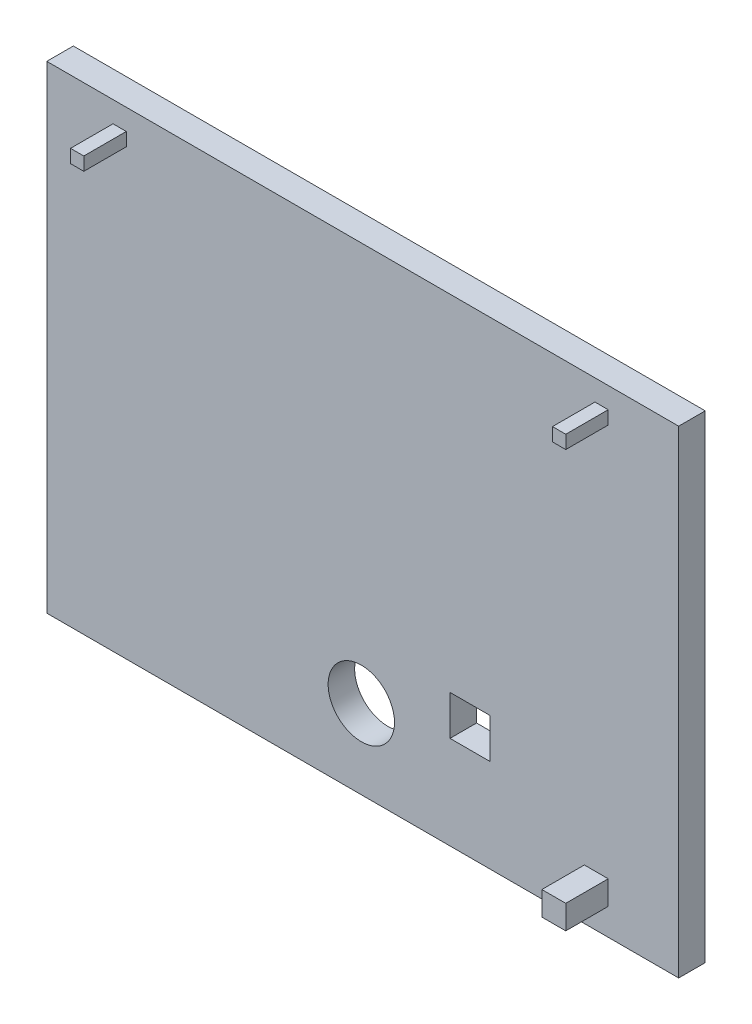
from build123d import *

# Parameters (mm, degrees)
SKETCH1_W           = 119
SKETCH1_H           = 90
SKETCH1_R           = 6.25
SKETCH1_W_2         = 7.5
SKETCH1_H_2         = 7.5
BOSS_EXTRUDE1_DEPTH = 5
SKETCH1_3_W         = 2.5
SKETCH1_3_H         = 2.5
SKETCH1_3_W_2       = 4.5
SKETCH1_3_H_2       = 4.5
BOSS_EXTRUDE2_DEPTH = 13


with BuildPart() as part:
    # Sketch1 → Boss-Extrude1 (new body)
    with BuildSketch(Plane.XY):
        with Locations((34.214905029, -83.582846692)):
            Rectangle(SKETCH1_W, SKETCH1_H)
        with Locations((33.949905029, -113.682846692)):
            Circle(SKETCH1_R, mode=Mode.SUBTRACT)
        with Locations((54.399905029, -107.282846692)):
            Rectangle(SKETCH1_W_2, SKETCH1_H_2, mode=Mode.SUBTRACT)
    extrude(amount=BOSS_EXTRUDE1_DEPTH)

    # Sketch1<3> → Boss-Extrude2 (add)
    with BuildSketch(Plane.XY):
        with Locations((-11.560094971, -43.782846692)):
            Rectangle(SKETCH1_3_W, SKETCH1_3_H)
        with Locations((79.199905029, -43.782846692)):
            Rectangle(SKETCH1_3_W, SKETCH1_3_H)
        with Locations((78.199905029, -121.282846692)):
            Rectangle(SKETCH1_3_W_2, SKETCH1_3_H_2)
    extrude(amount=BOSS_EXTRUDE2_DEPTH)


solid = part.part
